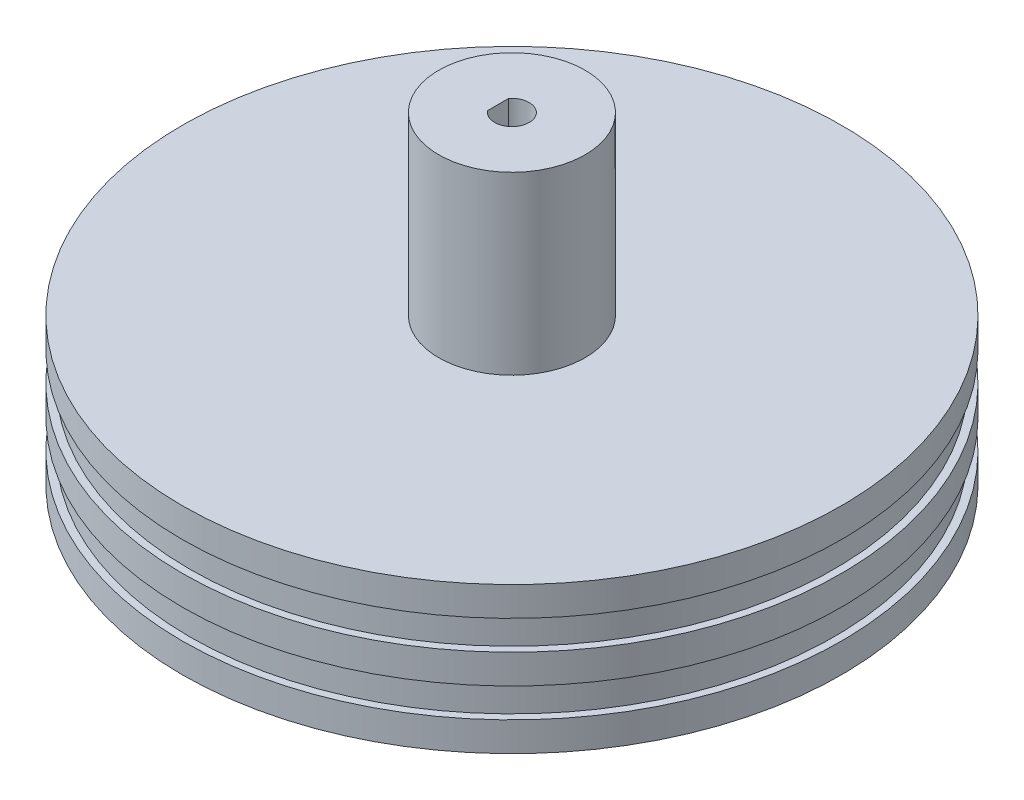
from build123d import *

# Parameters (mm, degrees)
SKETCH1_R           = 28.575
BOSS_EXTRUDE1_DEPTH = 2.54
SKETCH2_R           = 27.94
BOSS_EXTRUDE2_DEPTH = 2.54
SKETCH3_R           = 28.575
BOSS_EXTRUDE3_DEPTH = 2.54
SKETCH4_R           = 27.94
BOSS_EXTRUDE4_DEPTH = 2.54
SKETCH5_R           = 28.575
BOSS_EXTRUDE5_DEPTH = 2.54
SKETCH6_R           = 6.35
BOSS_EXTRUDE6_DEPTH = 15.24
CUT_EXTRUDE1_DEPTH  = 12.7


with BuildPart() as part:
    # Sketch1 → Boss-Extrude1 (new body)
    with BuildSketch(Plane(origin=(0, 0, 0), x_dir=(1, 0, 0), z_dir=(0, 1, 0))):
        with Locations(Location((0, 0, 0), (0, 0, 270))):
            Circle(SKETCH1_R)
    extrude(amount=BOSS_EXTRUDE1_DEPTH)

    # Sketch2 → Boss-Extrude2 (add)
    with BuildSketch(Plane(origin=(0, 2.54, 0), x_dir=(1, 0, 0), z_dir=(0, 1, 0))):
        with Locations(Location((0, 0, 0), (0, 0, 270))):
            Circle(SKETCH2_R)
    extrude(amount=BOSS_EXTRUDE2_DEPTH)

    # Sketch3 → Boss-Extrude3 (add)
    with BuildSketch(Plane(origin=(0, 5.08, 0), x_dir=(1, 0, 0), z_dir=(0, 1, 0))):
        with Locations(Location((0, 0, 0), (0, 0, 270))):
            Circle(SKETCH3_R)
    extrude(amount=BOSS_EXTRUDE3_DEPTH)

    # Sketch4 → Boss-Extrude4 (add)
    with BuildSketch(Plane(origin=(0, 7.62, 0), x_dir=(1, 0, 0), z_dir=(0, 1, 0))):
        with Locations(Location((0, 0, 0), (0, 0, 270))):
            Circle(SKETCH4_R)
    extrude(amount=BOSS_EXTRUDE4_DEPTH)

    # Sketch5 → Boss-Extrude5 (add)
    with BuildSketch(Plane(origin=(0, 10.16, 0), x_dir=(1, 0, 0), z_dir=(0, 1, 0))):
        with Locations(Location((0, 0, 0), (0, 0, 270))):
            Circle(SKETCH5_R)
    extrude(amount=BOSS_EXTRUDE5_DEPTH)

    # Sketch6 → Boss-Extrude6 (add)
    with BuildSketch(Plane(origin=(0, 12.7, 0), x_dir=(1, 0, 0), z_dir=(0, 1, 0))):
        with Locations(Location((0, 0, 0), (0, 0, 90))):
            Circle(SKETCH6_R)
    extrude(amount=BOSS_EXTRUDE6_DEPTH)

    # Sketch7 → Cut-Extrude1 (cut)
    with BuildSketch(Plane(origin=(0, 27.94, 0), x_dir=(1, 0, 0), z_dir=(0, 1, 0))):
        with BuildLine():
            Line((-1.200000076, 0.899999978), (-1.200000076, -0.899999978))
            ThreePointArc((-1.200000076, -0.899999978), (1.500000048, 0), (-1.200000076, 0.899999978))
        make_face()
    extrude(amount=-CUT_EXTRUDE1_DEPTH, mode=Mode.SUBTRACT)


solid = part.part
